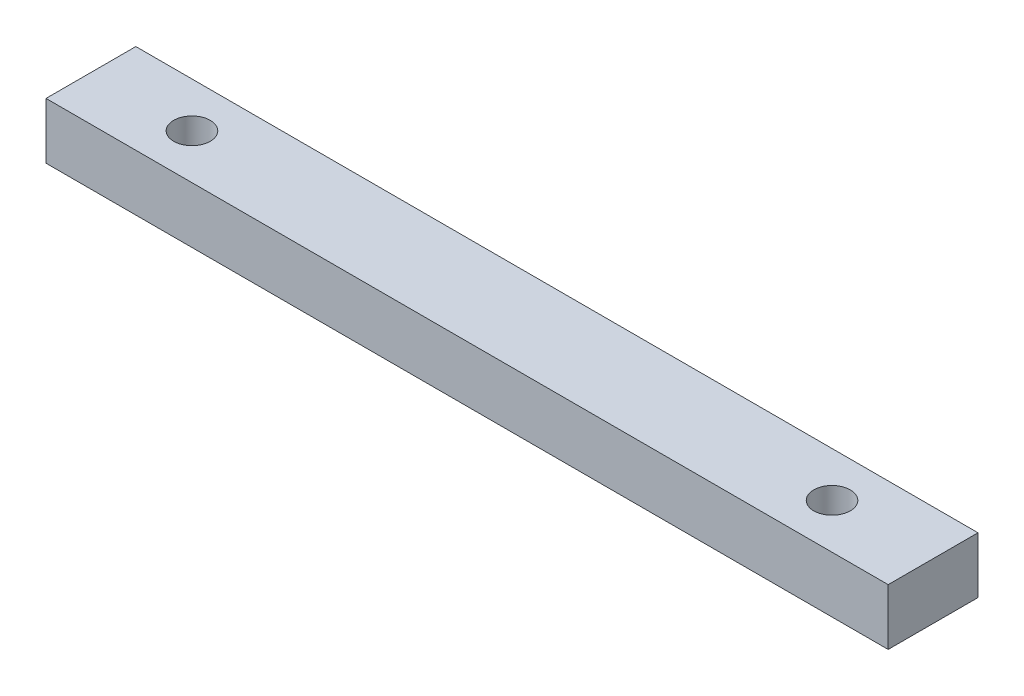
from build123d import *

# Parameters (mm, degrees)
SKETCH1_W           = 150
SKETCH1_H           = 16
BOSS_EXTRUDE1_DEPTH = 10
CUT_EXTRUDE1_REACH  = 78.085
SKETCH2_R           = 3.25


with BuildPart() as part:
    # Sketch1 → Boss-Extrude1 (new body)
    with BuildSketch(Plane(origin=(0, 0, 0), x_dir=(1, 0, 0), z_dir=(0, 1, 0))):
        Rectangle(SKETCH1_W, SKETCH1_H)
    extrude(amount=BOSS_EXTRUDE1_DEPTH)

    # Sketch2 → Cut-Extrude1 (cut, up to next)
    with BuildSketch(Plane(origin=(0, 10, 0), x_dir=(1, 0, 0), z_dir=(0, 1, 0)), mode=Mode.PRIVATE) as cut_extrude1_sk1:
        with Locations(Location((-57, 0, 0), (0, 0, 270))):
            Circle(SKETCH2_R)
    cut_extrude1_tool1 = extrude(cut_extrude1_sk1.sketch, amount=-CUT_EXTRUDE1_REACH, mode=Mode.PRIVATE) & part.part
    # Sketch2 → Cut-Extrude1 (cut, up to next)
    with BuildSketch(Plane(origin=(0, 10, 0), x_dir=(1, 0, 0), z_dir=(0, 1, 0)), mode=Mode.PRIVATE) as cut_extrude1_sk2:
        with Locations(Location((57, 0, 0), (0, 0, 90))):
            Circle(SKETCH2_R)
    cut_extrude1_tool2 = extrude(cut_extrude1_sk2.sketch, amount=-CUT_EXTRUDE1_REACH, mode=Mode.PRIVATE) & part.part
    add(cut_extrude1_tool1.solids().sort_by_distance((-57, 10, 0))[0], mode=Mode.SUBTRACT)
    add(cut_extrude1_tool2.solids().sort_by_distance((57, 10, 0))[0], mode=Mode.SUBTRACT)


solid = part.part
